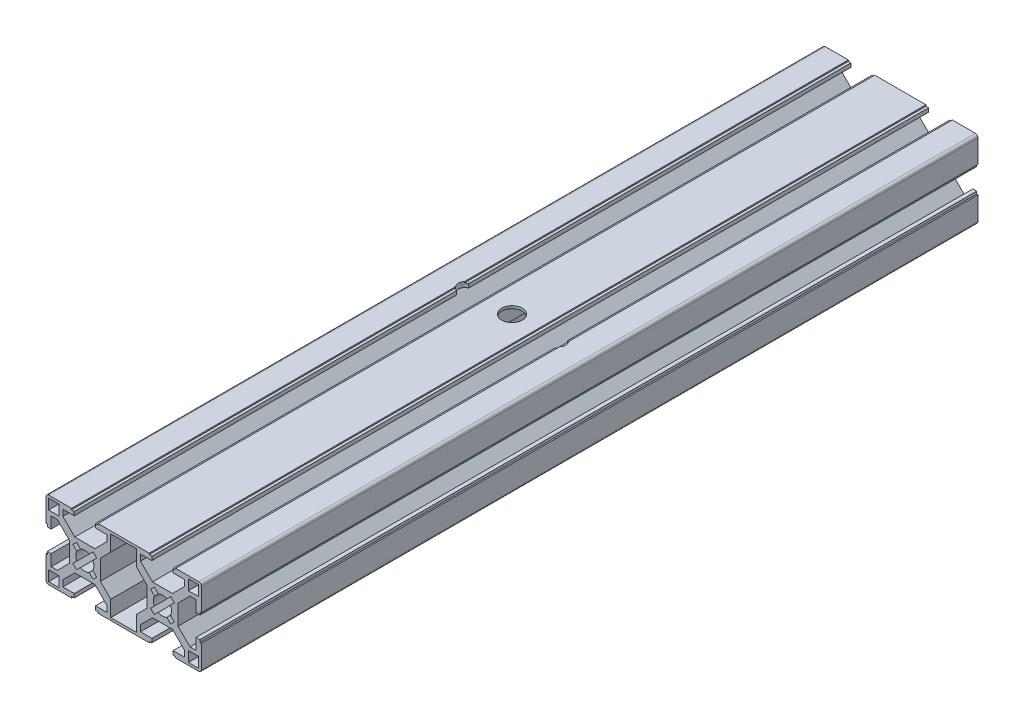
from build123d import *

# Parameters (mm, degrees)
ESBO_O1_W                      = 4
ESBO_O1_H                      = 4
RESSALTO_EXTRUS_O1_DEPTH       = 300
PADR_OCIRCULAR1_COUNT          = 4
PADR_O_LINEAR1_COUNT           = 2
PADR_O_LINEAR1_PITCH           = 30
PADR_O_LINEAR1_COPY_1_SKETCH_W = 4
PADR_O_LINEAR1_COPY_1_SKETCH_H = 4
PADR_O_LINEAR1_COPY_1_DEPTH    = 300
PADR_O_LINEAR1_COPY_2_SKETCH_W = 4
PADR_O_LINEAR1_COPY_2_SKETCH_H = 4
PADR_O_LINEAR1_COPY_2_DEPTH    = 300
PADR_O_LINEAR1_COPY_3_SKETCH_W = 4
PADR_O_LINEAR1_COPY_3_SKETCH_H = 4
PADR_O_LINEAR1_COPY_3_DEPTH    = 300
ESBO_O4_W                      = 10
ESBO_O4_H                      = 28
CORTE_EXTRUS_O1_DEPTH          = 304.72685097
FILETE1_R                      = 1
SKETCH1_R                      = 2.5
CUT_EXTRUDE1_DEPTH             = 3
SKETCH2_R                      = 4
CUT_EXTRUDE2_DEPTH             = 305.836021494


with BuildPart() as part:
    # Esboço1 → Ressalto-extrusão1 (new body)
    with BuildSketch(Plane.XY):
        with BuildLine():
            ThreePointArc((-1.664601464, 3.078815026), (-0.858529967, 3.393070335), (0, 3.5))
            Line((0, 3.5), (0, 6))
            Line((0, 6), (-3.878679656, 6))
            Line((-3.878679656, 6), (-8.5, 10.621320344))
            Line((-8.5, 10.621320344), (-8.5, 13))
            Line((-8.5, 13), (-4.1, 13))
            Line((-4.1, 13), (-4.1, 14.5))
            Line((-4.1, 14.5), (-5.1, 14.5))
            Line((-5.1, 14.5), (-5.1, 15))
            Line((-5.1, 15), (-15, 15))
            Line((-15, 15), (-15, 5.1))
            Line((-15, 5.1), (-14.5, 5.1))
            Line((-14.5, 5.1), (-14.5, 4.1))
            Line((-14.5, 4.1), (-13, 4.1))
            Line((-13, 4.1), (-13, 8.5))
            Line((-13, 8.5), (-10.621320344, 8.5))
            Line((-10.621320344, 8.5), (-6, 3.878679656))
            Line((-6, 3.878679656), (-6, 0))
            Line((-6, 0), (-3.5, 0))
            ThreePointArc((-3.5, 0), (-3.393070335, 0.858529967), (-3.078815026, 1.664601464))
            Line((-3.078815026, 1.664601464), (-4.596194078, 3.181980515))
            Line((-4.596194078, 3.181980515), (-3.181980515, 4.596194078))
            Line((-3.181980515, 4.596194078), (-1.664601464, 3.078815026))
        make_face()
        with Locations((-12, 12)):
            Rectangle(ESBO_O1_W, ESBO_O1_H, mode=Mode.SUBTRACT)
    ressalto_extrus_o1 = extrude(amount=RESSALTO_EXTRUS_O1_DEPTH)

    # PadrãoCircular1: Ressalto-extrusão1 ×4 about axis
    padr_ocircular1_axis = Axis((0, 0, 0), (0, 0, 1))
    for i in range(1, PADR_OCIRCULAR1_COUNT):
        add(ressalto_extrus_o1.rotate(padr_ocircular1_axis, i * 360 / PADR_OCIRCULAR1_COUNT))

    # Padrão linear1: Ressalto-extrusão1 ×2
    with Locations(*[(i * PADR_O_LINEAR1_PITCH, 0, 0) for i in range(1, PADR_O_LINEAR1_COUNT)]):
        add(ressalto_extrus_o1)

    # Padrão linear1 copy 1 sketch → Padrão linear1 copy 1 (add)
    with BuildSketch(Plane(origin=(30, 0, 0), x_dir=(0, 1, 0), z_dir=(0, 0, 1))):
        with BuildLine():
            ThreePointArc((-1.664601464, 3.078815026), (-0.858529967, 3.393070335), (0, 3.5))
            Line((0, 3.5), (0, 6))
            Line((0, 6), (-3.878679656, 6))
            Line((-3.878679656, 6), (-8.5, 10.621320344))
            Line((-8.5, 10.621320344), (-8.5, 13))
            Line((-8.5, 13), (-4.1, 13))
            Line((-4.1, 13), (-4.1, 14.5))
            Line((-4.1, 14.5), (-5.1, 14.5))
            Line((-5.1, 14.5), (-5.1, 15))
            Line((-5.1, 15), (-15, 15))
            Line((-15, 15), (-15, 5.1))
            Line((-15, 5.1), (-14.5, 5.1))
            Line((-14.5, 5.1), (-14.5, 4.1))
            Line((-14.5, 4.1), (-13, 4.1))
            Line((-13, 4.1), (-13, 8.5))
            Line((-13, 8.5), (-10.621320344, 8.5))
            Line((-10.621320344, 8.5), (-6, 3.878679656))
            Line((-6, 3.878679656), (-6, 0))
            Line((-6, 0), (-3.5, 0))
            ThreePointArc((-3.5, 0), (-3.393070335, 0.858529967), (-3.078815026, 1.664601464))
            Line((-3.078815026, 1.664601464), (-4.596194078, 3.181980515))
            Line((-4.596194078, 3.181980515), (-3.181980515, 4.596194078))
            Line((-3.181980515, 4.596194078), (-1.664601464, 3.078815026))
        make_face()
        with Locations((-12, 12)):
            Rectangle(PADR_O_LINEAR1_COPY_1_SKETCH_W, PADR_O_LINEAR1_COPY_1_SKETCH_H, mode=Mode.SUBTRACT)
    extrude(amount=PADR_O_LINEAR1_COPY_1_DEPTH)

    # Padrão linear1 copy 2 sketch → Padrão linear1 copy 2 (add)
    with BuildSketch(Plane(origin=(30, 0, 0), x_dir=(-1, 0, 0), z_dir=(0, 0, 1))):
        with BuildLine():
            ThreePointArc((-1.664601464, 3.078815026), (-0.858529967, 3.393070335), (0, 3.5))
            Line((0, 3.5), (0, 6))
            Line((0, 6), (-3.878679656, 6))
            Line((-3.878679656, 6), (-8.5, 10.621320344))
            Line((-8.5, 10.621320344), (-8.5, 13))
            Line((-8.5, 13), (-4.1, 13))
            Line((-4.1, 13), (-4.1, 14.5))
            Line((-4.1, 14.5), (-5.1, 14.5))
            Line((-5.1, 14.5), (-5.1, 15))
            Line((-5.1, 15), (-15, 15))
            Line((-15, 15), (-15, 5.1))
            Line((-15, 5.1), (-14.5, 5.1))
            Line((-14.5, 5.1), (-14.5, 4.1))
            Line((-14.5, 4.1), (-13, 4.1))
            Line((-13, 4.1), (-13, 8.5))
            Line((-13, 8.5), (-10.621320344, 8.5))
            Line((-10.621320344, 8.5), (-6, 3.878679656))
            Line((-6, 3.878679656), (-6, 0))
            Line((-6, 0), (-3.5, 0))
            ThreePointArc((-3.5, 0), (-3.393070335, 0.858529967), (-3.078815026, 1.664601464))
            Line((-3.078815026, 1.664601464), (-4.596194078, 3.181980515))
            Line((-4.596194078, 3.181980515), (-3.181980515, 4.596194078))
            Line((-3.181980515, 4.596194078), (-1.664601464, 3.078815026))
        make_face()
        with Locations((-12, 12)):
            Rectangle(PADR_O_LINEAR1_COPY_2_SKETCH_W, PADR_O_LINEAR1_COPY_2_SKETCH_H, mode=Mode.SUBTRACT)
    extrude(amount=PADR_O_LINEAR1_COPY_2_DEPTH)

    # Padrão linear1 copy 3 sketch → Padrão linear1 copy 3 (add)
    with BuildSketch(Plane(origin=(30, 0, 0), x_dir=(0, -1, 0), z_dir=(0, 0, 1))):
        with BuildLine():
            ThreePointArc((-1.664601464, 3.078815026), (-0.858529967, 3.393070335), (0, 3.5))
            Line((0, 3.5), (0, 6))
            Line((0, 6), (-3.878679656, 6))
            Line((-3.878679656, 6), (-8.5, 10.621320344))
            Line((-8.5, 10.621320344), (-8.5, 13))
            Line((-8.5, 13), (-4.1, 13))
            Line((-4.1, 13), (-4.1, 14.5))
            Line((-4.1, 14.5), (-5.1, 14.5))
            Line((-5.1, 14.5), (-5.1, 15))
            Line((-5.1, 15), (-15, 15))
            Line((-15, 15), (-15, 5.1))
            Line((-15, 5.1), (-14.5, 5.1))
            Line((-14.5, 5.1), (-14.5, 4.1))
            Line((-14.5, 4.1), (-13, 4.1))
            Line((-13, 4.1), (-13, 8.5))
            Line((-13, 8.5), (-10.621320344, 8.5))
            Line((-10.621320344, 8.5), (-6, 3.878679656))
            Line((-6, 3.878679656), (-6, 0))
            Line((-6, 0), (-3.5, 0))
            ThreePointArc((-3.5, 0), (-3.393070335, 0.858529967), (-3.078815026, 1.664601464))
            Line((-3.078815026, 1.664601464), (-4.596194078, 3.181980515))
            Line((-4.596194078, 3.181980515), (-3.181980515, 4.596194078))
            Line((-3.181980515, 4.596194078), (-1.664601464, 3.078815026))
        make_face()
        with Locations((-12, 12)):
            Rectangle(PADR_O_LINEAR1_COPY_3_SKETCH_W, PADR_O_LINEAR1_COPY_3_SKETCH_H, mode=Mode.SUBTRACT)
    extrude(amount=PADR_O_LINEAR1_COPY_3_DEPTH)

    # Esboço4 → Corte-extrusão1 (cut, through all)
    with BuildSketch(Plane(origin=(0, 0, 0), x_dir=(-1, 0, 0), z_dir=(0, 0, -1))):
        with Locations((-15, 0)):
            Rectangle(ESBO_O4_W, ESBO_O4_H)
    extrude(amount=-CORTE_EXTRUS_O1_DEPTH, mode=Mode.SUBTRACT)

    # Filete1
    filete1_edges = [part.edges().sort_by_distance(p)[0] for p in [
        (45, -15, 150),
        (45, 15, 150),
        (-15, 15, 150),
        (-15, -15, 150),
    ]]
    fillet(filete1_edges, radius=FILETE1_R)

    # Sketch1 → Cut-Extrude1 (cut)
    with BuildSketch(Plane(origin=(0, 15, 0), x_dir=(1, 0, 0), z_dir=(0, 1, 0))):
        with BuildLine():
            ThreePointArc((19, -150), (17.54586978, -146.914785735), (14.24072647, -146.072723118))
            Line((14.24072647, -146.072723118), (15.75927353, -153.927276882))
            ThreePointArc((15.75927353, -153.927276882), (18.085214265, -152.54586978), (19, -150))
        make_face()
        with BuildLine():
            Line((15.75927353, -153.927276882), (14.24072647, -146.072723118))
            ThreePointArc((14.24072647, -146.072723118), (11.072723118, -150.75927353), (15.75927353, -153.927276882))
        make_face()
        with Locations((33.25, -150)):
            Circle(SKETCH1_R)
        with Locations((-3.25, -150)):
            Circle(SKETCH1_R)
    extrude(amount=-CUT_EXTRUDE1_DEPTH, mode=Mode.SUBTRACT)

    # Sketch2 → Cut-Extrude2 (cut, through all)
    with BuildSketch(Plane(origin=(0, 15, 0), x_dir=(1, 0, 0), z_dir=(0, 1, 0))):
        with Locations(Location((15, -150, 0), (0, 0, 180))):
            Circle(SKETCH2_R)
    extrude(amount=-CUT_EXTRUDE2_DEPTH, mode=Mode.SUBTRACT)


solid = part.part
